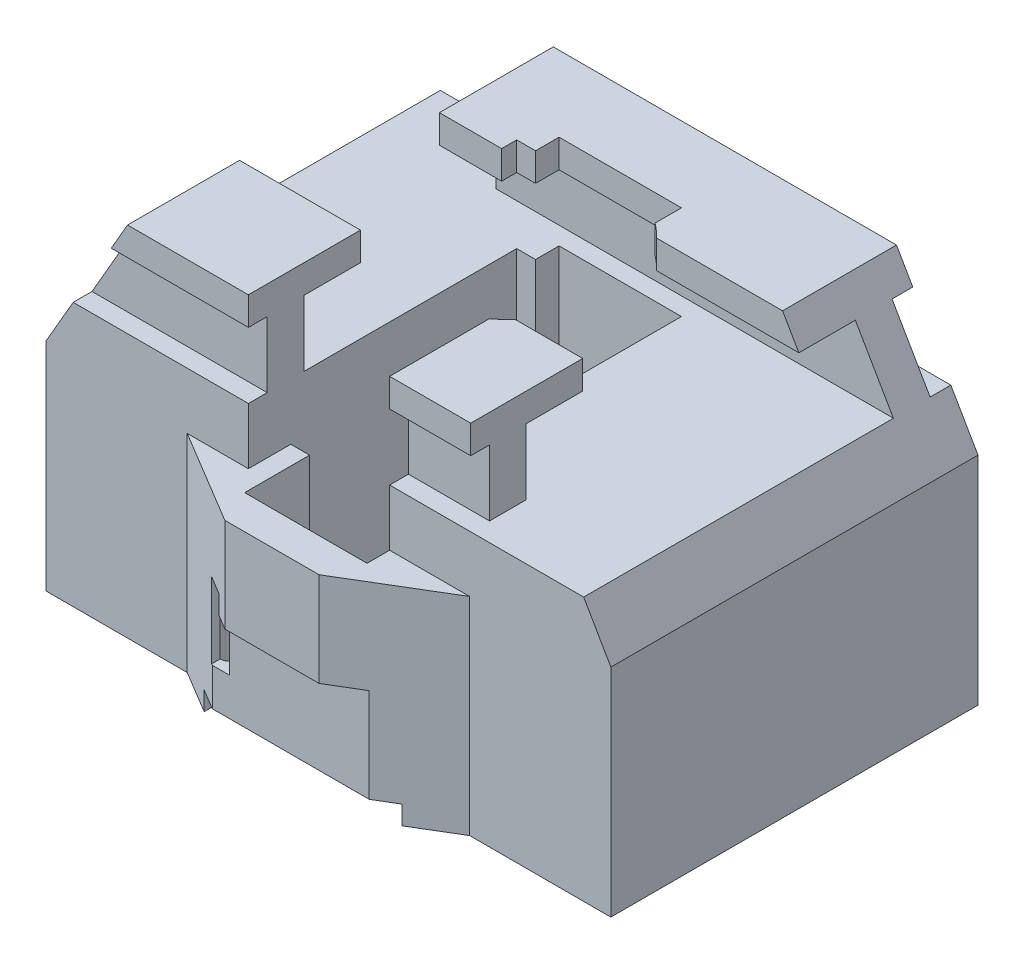
from build123d import *
from OCP.BRepFilletAPI import BRepFilletAPI_MakeChamfer

# Parameters (mm, degrees)
SKETCH1_W                = 60
SKETCH1_H                = 45
BOSS_EXTRUDE1_DEPTH      = 30
SKETCH2_W                = 6.5
SKETCH2_H                = 16
CUT_EXTRUDE1_DEPTH       = 20
CHAMFER1_SIZE            = 5
CHAMFER1_SIZE2           = 0.437443318
CHAMFER2_SIZE            = 5
CHAMFER2_SIZE2           = 5.958767963
CUT_EXTRUDE2_DEPTH       = 10
CHAMFER3_SIZE            = 3
CHAMFER3_SIZE2           = 1.5
CUT_EXTRUDE3_REACH       = 82.777
SKETCH6_W                = 28
SKETCH6_H                = 31
CUT_EXTRUDE4_DEPTH       = 1
BOSS_EXTRUDE2_DEPTH      = 22
CUT_EXTRUDE5_REACH       = 80.16
SKETCH7_W                = 13
SKETCH7_H                = 23.4
CUT_EXTRUDE6_REACH       = 95.485
CUT_EXTRUDE6_START       = -15.6
SKETCH8_W                = 13
SKETCH8_H                = 5
CUT_EXTRUDE7_REACH       = 80.16
BOSS_EXTRUDE3_DEPTH      = 16
CHAMFER6_SIZE            = 15
CHAMFER6_SIZE2           = 8.660254038
SKETCH14_R               = 11
CUT_EXTRUDE8_DEPTH       = 10
SKETCH15_W               = 70
SKETCH15_H               = 15
CUT_EXTRUDE9_DEPTH       = 10
CUT_EXTRUDE10_DEPTH      = 71.3651192
CUT_EXTRUDE10_DEPTH_BACK = 71.3651192
SKETCH16_W               = 6
SKETCH16_H               = 7
SKETCH16_W_2             = 2
CUT_EXTRUDE11_DEPTH      = 71.3651192
CUT_EXTRUDE11_DEPTH_BACK = 71.3651192
SKETCH17_W               = 6
SKETCH17_H               = 7
SKETCH17_W_2             = 2.2
SKETCH18_W               = 21
SKETCH18_H               = 8
CUT_EXTRUDE12_DEPTH      = 2
SKETCH19_R               = 1
SKETCH19_W               = 18.34106835
SKETCH19_H               = 5.189180314
CUT_EXTRUDE13_DEPTH      = 10
CUT_EXTRUDE14_REACH      = 80.957
SKETCH20_W               = 2
SKETCH20_H               = 8
CUT_EXTRUDE15_REACH      = 86.077
SKETCH21_W               = 16.800854114
SKETCH21_H               = 23.16859679
SKETCH21_W_2             = 25.313746617
SKETCH21_H_2             = 27.258932471


with BuildPart() as part:
    # Sketch1 → Boss-Extrude1 (new body)
    with BuildSketch(Plane(origin=(0, 0, 0), x_dir=(1, 0, 0), z_dir=(0, 1, 0))):
        with Locations((-30, 22.5)):
            Rectangle(SKETCH1_W, SKETCH1_H)
    extrude(amount=BOSS_EXTRUDE1_DEPTH)

    # Sketch2 → Cut-Extrude1 (cut)
    with BuildSketch(Plane(origin=(0, 0, 0), x_dir=(-1, 0, 0), z_dir=(0, -1, 0))):
        with Locations((47.5, 21)):
            Rectangle(SKETCH2_W, SKETCH2_H)
        with Locations((13, 21)):
            Rectangle(SKETCH2_W, SKETCH2_H)
    extrude(amount=-CUT_EXTRUDE1_DEPTH, mode=Mode.SUBTRACT)

    # Chamfer1: one chamfer whose edges measure the first distance from different faces: ONE call of the kernel's chamfer builder (chamfer() names one face for all edges)
    chamfer1_edges_1 = [part.edges().sort_by_distance(p)[0] for p in [
        (-50.75, 20, -21),
    ]]
    chamfer1_side_1 = [part.faces().sort_by_distance(p)[0] for p in [
        (-50.75, 10, -21),
    ]]
    chamfer1_edges_2 = [part.edges().sort_by_distance(p)[0] for p in [
        (-44.25, 20, -21),
    ]]
    chamfer1_side_2 = [part.faces().sort_by_distance(p)[0] for p in [
        (-44.25, 10, -21),
    ]]
    chamfer1_edges_3 = [part.edges().sort_by_distance(p)[0] for p in [
        (-16.25, 20, -21),
    ]]
    chamfer1_side_3 = [part.faces().sort_by_distance(p)[0] for p in [
        (-16.25, 10, -21),
    ]]
    chamfer1_edges_4 = [part.edges().sort_by_distance(p)[0] for p in [
        (-9.75, 20, -21),
    ]]
    chamfer1_side_4 = [part.faces().sort_by_distance(p)[0] for p in [
        (-9.75, 10, -21),
    ]]
    chamfer1 = BRepFilletAPI_MakeChamfer(part.part.solid().wrapped)
    for e in chamfer1_edges_1:
        chamfer1.Add(CHAMFER1_SIZE, CHAMFER1_SIZE2, e.wrapped, chamfer1_side_1[0].wrapped)  # the first distance lies on this face
    for e in chamfer1_edges_2:
        chamfer1.Add(CHAMFER1_SIZE, CHAMFER1_SIZE2, e.wrapped, chamfer1_side_2[0].wrapped)  # the first distance lies on this face
    for e in chamfer1_edges_3:
        chamfer1.Add(CHAMFER1_SIZE, CHAMFER1_SIZE2, e.wrapped, chamfer1_side_3[0].wrapped)  # the first distance lies on this face
    for e in chamfer1_edges_4:
        chamfer1.Add(CHAMFER1_SIZE, CHAMFER1_SIZE2, e.wrapped, chamfer1_side_4[0].wrapped)  # the first distance lies on this face
    add(Compound.cast(chamfer1.Shape()), mode=Mode.REPLACE)

    # Chamfer2: one chamfer whose edges measure the first distance from different faces: ONE call of the kernel's chamfer builder (chamfer() names one face for all edges)
    chamfer2_edges_1 = [part.edges().sort_by_distance(p)[0] for p in [
        (-47.5, 20, -29),
    ]]
    chamfer2_side_1 = [part.faces().sort_by_distance(p)[0] for p in [
        (-47.5, 9.857394508, -29),
    ]]
    chamfer2_edges_2 = [part.edges().sort_by_distance(p)[0] for p in [
        (-13, 20, -29),
    ]]
    chamfer2_side_2 = [part.faces().sort_by_distance(p)[0] for p in [
        (-13, 9.857394508, -29),
    ]]
    chamfer2_edges_3 = [part.edges().sort_by_distance(p)[0] for p in [
        (-13, 20, -13),
    ]]
    chamfer2_side_3 = [part.faces().sort_by_distance(p)[0] for p in [
        (-13, 9.857394508, -13),
    ]]
    chamfer2_edges_4 = [part.edges().sort_by_distance(p)[0] for p in [
        (-47.5, 20, -13),
    ]]
    chamfer2_side_4 = [part.faces().sort_by_distance(p)[0] for p in [
        (-47.5, 9.857394508, -13),
    ]]
    chamfer2 = BRepFilletAPI_MakeChamfer(part.part.solid().wrapped)
    for e in chamfer2_edges_1:
        chamfer2.Add(CHAMFER2_SIZE, CHAMFER2_SIZE2, e.wrapped, chamfer2_side_1[0].wrapped)  # the first distance lies on this face
    for e in chamfer2_edges_2:
        chamfer2.Add(CHAMFER2_SIZE, CHAMFER2_SIZE2, e.wrapped, chamfer2_side_2[0].wrapped)  # the first distance lies on this face
    for e in chamfer2_edges_3:
        chamfer2.Add(CHAMFER2_SIZE, CHAMFER2_SIZE2, e.wrapped, chamfer2_side_3[0].wrapped)  # the first distance lies on this face
    for e in chamfer2_edges_4:
        chamfer2.Add(CHAMFER2_SIZE, CHAMFER2_SIZE2, e.wrapped, chamfer2_side_4[0].wrapped)  # the first distance lies on this face
    add(Compound.cast(chamfer2.Shape()), mode=Mode.REPLACE)

    # Sketch4 → Cut-Extrude2 (cut)
    with BuildSketch(Plane(origin=(0, 0, -45), x_dir=(-1, 0, 0), z_dir=(0, 0, -1))):
        with BuildLine():
            Line((11.5, 0), (28.3, 0))
            ThreePointArc((28.3, 0), (34.080602383, 6.276082414), (42.61191296, 6.13008847))
            ThreePointArc((42.61191296, 6.13008847), (47.088831578, 7.478397416), (46.230644896, 12.074510224))
            ThreePointArc((46.230644896, 12.074510224), (25.608734298, 15.404376803), (11.5, 0))
        make_face()
    extrude(amount=-CUT_EXTRUDE2_DEPTH, mode=Mode.SUBTRACT)

    # Chamfer3
    chamfer3_edges = [part.edges().sort_by_distance(p)[0] for p in [
        (-50.75, 0, -21),
        (-47.5, 0, -29),
        (-44.25, 0, -21),
        (-47.5, 0, -13),
        (-16.25, 0, -21),
        (-13, 0, -29),
        (-9.75, 0, -21),
        (-13, 0, -13),
    ]]
    chamfer3_side = [part.faces().sort_by_distance(p)[0] for p in [
        (-30.707745267, 0, -21.36919105),
    ]]
    chamfer(chamfer3_edges, length=CHAMFER3_SIZE, length2=CHAMFER3_SIZE2, reference=chamfer3_side[0])

    # Sketch5 → Cut-Extrude3 (cut, up to next)
    with BuildSketch(Plane.ZY.offset(60), mode=Mode.PRIVATE) as cut_extrude3_sk1:
        Polygon((-45, 30), (0, 30), (0, 0), (-6, 0), (-6, 22), (-45, 22), align=None)
    cut_extrude3_tool1 = extrude(cut_extrude3_sk1.sketch, amount=-CUT_EXTRUDE3_REACH, mode=Mode.PRIVATE) & part.part
    add(cut_extrude3_tool1.solids().sort_by_distance((-60, 29.459167, -22.5))[0], mode=Mode.SUBTRACT)

    # Sketch6 → Cut-Extrude4 (cut)
    with BuildSketch(Plane(origin=(0, 0, 0), x_dir=(-1, 0, 0), z_dir=(0, -1, 0))):
        with Locations((30.25, 21.5)):
            Rectangle(SKETCH6_W, SKETCH6_H)
    extrude(amount=-CUT_EXTRUDE4_DEPTH, mode=Mode.SUBTRACT)

    # Sketch12 → Boss-Extrude2 (add)
    with BuildSketch(Plane.XZ):
        Polygon((-45, -6), (-35, 0), (-25, 0), (-15, -6), align=None)
    extrude(amount=-BOSS_EXTRUDE2_DEPTH)

    # Sketch7 → Cut-Extrude5 (cut, up to next)
    with BuildSketch(Plane(origin=(0, 22, 0), x_dir=(1, 0, 0), z_dir=(0, 1, 0)), mode=Mode.PRIVATE) as cut_extrude5_sk1:
        with Locations((-30, 20.3)):
            Rectangle(SKETCH7_W, SKETCH7_H)
    cut_extrude5_tool1 = extrude(cut_extrude5_sk1.sketch, amount=-CUT_EXTRUDE5_REACH, mode=Mode.PRIVATE) & part.part
    add(cut_extrude5_tool1.solids().sort_by_distance((-30, 22, -20.3))[0], mode=Mode.SUBTRACT)

    # Sketch8 → Cut-Extrude6 (cut, up to next)
    with BuildSketch(Plane.XZ.offset(-1).offset(CUT_EXTRUDE6_START), mode=Mode.PRIVATE) as cut_extrude6_sk1:
        with Locations((-30, -6.1)):
            Rectangle(SKETCH8_W, SKETCH8_H)
    cut_extrude6_tool1 = extrude(cut_extrude6_sk1.sketch, amount=-CUT_EXTRUDE6_REACH, mode=Mode.PRIVATE) & part.part
    # Sketch8 → Cut-Extrude6 (cut, up to next)
    with BuildSketch(Plane.XZ.offset(-1).offset(CUT_EXTRUDE6_START), mode=Mode.PRIVATE) as cut_extrude6_sk2:
        with Locations((-30, -34.5)):
            Rectangle(SKETCH8_W, SKETCH8_H)
    cut_extrude6_tool2 = extrude(cut_extrude6_sk2.sketch, amount=-CUT_EXTRUDE6_REACH, mode=Mode.PRIVATE) & part.part
    add(cut_extrude6_tool1.solids().sort_by_distance((-30, 16.6, -6.1))[0], mode=Mode.SUBTRACT)
    add(cut_extrude6_tool2.solids().sort_by_distance((-30, 16.6, -34.5))[0], mode=Mode.SUBTRACT)

    # Sketch10 → Cut-Extrude7 (cut, up to next)
    with BuildSketch(Plane(origin=(0, 22, 0), x_dir=(1, 0, 0), z_dir=(0, 1, 0)), mode=Mode.PRIVATE) as cut_extrude7_sk1:
        Polygon((-27.5, 32), (-27.5, 34.5), (-38.5, 34.5), (-38.5, 10.5), (-36.5, 10.5), (-36.5, 32), align=None)
    cut_extrude7_tool1 = extrude(cut_extrude7_sk1.sketch, amount=-CUT_EXTRUDE7_REACH, mode=Mode.PRIVATE) & part.part
    add(cut_extrude7_tool1.solids().sort_by_distance((-27.764008, 22, -33.25))[0], mode=Mode.SUBTRACT)

    # Sketch13 → Boss-Extrude3 (add)
    with BuildSketch(Plane(origin=(0, 22, 0), x_dir=(1, 0, 0), z_dir=(0, 1, 0))):
        Polygon((-60, 45), (0, 45), (0, 6), (-15, 6), (-23.5, 6), (-23.5, 37), (-36.5, 37), (-36.5, 34.5), (-38.5, 34.5), (-38.5, 6), (-60, 6), align=None)
    extrude(amount=BOSS_EXTRUDE3_DEPTH)

    # Chamfer6: one chamfer whose edges measure the first distance from different faces: ONE call of the kernel's chamfer builder (chamfer() names one face for all edges)
    chamfer6_edges_1 = [part.edges().sort_by_distance(p)[0] for p in [
        (-60, 38, -25.5),
    ]]
    chamfer6_side_1 = [part.faces().sort_by_distance(p)[0] for p in [
        (-60, 19, -25.5),
    ]]
    chamfer6_edges_2 = [part.edges().sort_by_distance(p)[0] for p in [
        (0, 38, -25.5),
    ]]
    chamfer6_side_2 = [part.faces().sort_by_distance(p)[0] for p in [
        (0, 19, -25.5),
    ]]
    chamfer6 = BRepFilletAPI_MakeChamfer(part.part.solid().wrapped)
    for e in chamfer6_edges_1:
        chamfer6.Add(CHAMFER6_SIZE, CHAMFER6_SIZE2, e.wrapped, chamfer6_side_1[0].wrapped)  # the first distance lies on this face
    for e in chamfer6_edges_2:
        chamfer6.Add(CHAMFER6_SIZE, CHAMFER6_SIZE2, e.wrapped, chamfer6_side_2[0].wrapped)  # the first distance lies on this face
    add(Compound.cast(chamfer6.Shape()), mode=Mode.REPLACE)

    # Sketch14 → Cut-Extrude8 (cut)
    with BuildSketch(Plane(origin=(0, 38, 0), x_dir=(1, 0, 0), z_dir=(0, 1, 0))):
        with Locations((-30.1, 25.4)):
            Circle(SKETCH14_R)
    extrude(amount=-CUT_EXTRUDE8_DEPTH, mode=Mode.SUBTRACT)

    # Sketch15 → Cut-Extrude9 (cut)
    with BuildSketch(Plane(origin=(0, 38, 0), x_dir=(1, 0, 0), z_dir=(0, 1, 0))):
        with Locations((-30.1, 25.4)):
            Rectangle(SKETCH15_W, SKETCH15_H)
    extrude(amount=-CUT_EXTRUDE9_DEPTH, mode=Mode.SUBTRACT)

    # Sketch16 → Cut-Extrude10 (cut, two sides: drawn at the far end of the back side and taken through both)
    with BuildSketch(Plane(origin=(-38.5, 0, 0), x_dir=(0, 0, -1), z_dir=(1, 0, 0)).offset(-CUT_EXTRUDE10_DEPTH_BACK)):
        with Locations((14.9, 31.5)):
            Rectangle(SKETCH16_W, SKETCH16_H)
        with Locations((7, 31.5)):
            Rectangle(SKETCH16_W_2, SKETCH16_H)
    extrude(amount=CUT_EXTRUDE10_DEPTH + CUT_EXTRUDE10_DEPTH_BACK, mode=Mode.SUBTRACT)

    # Sketch17 → Cut-Extrude11 (cut, two sides: drawn at the far end of the back side and taken through both)
    with BuildSketch(Plane(origin=(-38.5, 0, 0), x_dir=(0, 0, -1), z_dir=(1, 0, 0)).offset(-CUT_EXTRUDE11_DEPTH_BACK)):
        with Locations((35.9, 31.5)):
            Rectangle(SKETCH17_W, SKETCH17_H)
        with Locations((43.9, 31.5)):
            Rectangle(SKETCH17_W_2, SKETCH17_H)
    extrude(amount=CUT_EXTRUDE11_DEPTH + CUT_EXTRUDE11_DEPTH_BACK, mode=Mode.SUBTRACT)

    # Sketch18 → Cut-Extrude12 (cut)
    with BuildSketch(Plane.XZ):
        with Locations((-30, -2)):
            Rectangle(SKETCH18_W, SKETCH18_H)
    extrude(amount=-CUT_EXTRUDE12_DEPTH, mode=Mode.SUBTRACT)

    # Sketch19 → Cut-Extrude13 (cut)
    with BuildSketch(Plane.XZ.offset(-2)):
        with Locations(Location((-38.5, -4, 0), (0, 0, 270))):
            Circle(SKETCH19_R)
        with Locations(Location((-22.5, -4, 0), (0, 0, 270))):
            Circle(SKETCH19_R)
        with Locations((-30, 0.594590157)):
            Rectangle(SKETCH19_W, SKETCH19_H)
    extrude(amount=-CUT_EXTRUDE13_DEPTH, mode=Mode.SUBTRACT)

    # Sketch20 → Cut-Extrude14 (cut, up to next)
    with BuildSketch(Plane(origin=(0, 0, -10.5), x_dir=(-1, 0, 0), z_dir=(0, 0, -1)), mode=Mode.PRIVATE) as cut_extrude14_sk1:
        with Locations((37.5, 10)):
            Rectangle(SKETCH20_W, SKETCH20_H)
    cut_extrude14_tool1 = extrude(cut_extrude14_sk1.sketch, amount=-CUT_EXTRUDE14_REACH, mode=Mode.PRIVATE) & part.part
    add(cut_extrude14_tool1.solids().sort_by_distance((-37.5, 10, -10.5))[0], mode=Mode.SUBTRACT)

    # Cut-Extrude15: up to this face of the body (flat: up to its plane)
    cut_extrude15_end = Plane(part.part.faces().sort_by_distance((-30, 28, -43.9))[0])
    # Sketch21 → Cut-Extrude15 (cut, up to the picked face)
    with BuildSketch(Plane(origin=(0, 38, 0), x_dir=(1, 0, 0), z_dir=(0, 1, 0)), mode=Mode.PRIVATE) as cut_extrude15_sk1:
        with Locations((-53.513675711, 40.114245734)):
            Rectangle(SKETCH21_W, SKETCH21_H)
    cut_extrude15_tool1 = split(extrude(cut_extrude15_sk1.sketch, amount=-CUT_EXTRUDE15_REACH, mode=Mode.PRIVATE), bisect_by=cut_extrude15_end, keep=Keep.BOTH, mode=Mode.PRIVATE)
    # Sketch21 → Cut-Extrude15 (cut, up to the picked face)
    with BuildSketch(Plane(origin=(0, 38, 0), x_dir=(1, 0, 0), z_dir=(0, 1, 0)), mode=Mode.PRIVATE) as cut_extrude15_sk2:
        with Locations((-2.229878037, 8.087664752)):
            Rectangle(SKETCH21_W_2, SKETCH21_H_2)
    cut_extrude15_tool2 = split(extrude(cut_extrude15_sk2.sketch, amount=-CUT_EXTRUDE15_REACH, mode=Mode.PRIVATE), bisect_by=cut_extrude15_end, keep=Keep.BOTH, mode=Mode.PRIVATE)
    add(cut_extrude15_tool1.solids().sort_by(Axis((-53.513676, 38, -40.114246), (0, -1, 0)))[0], mode=Mode.SUBTRACT)
    add(cut_extrude15_tool2.solids().sort_by(Axis((-2.229878, 38, -8.087665), (0, -1, 0)))[0], mode=Mode.SUBTRACT)


solid = part.part
